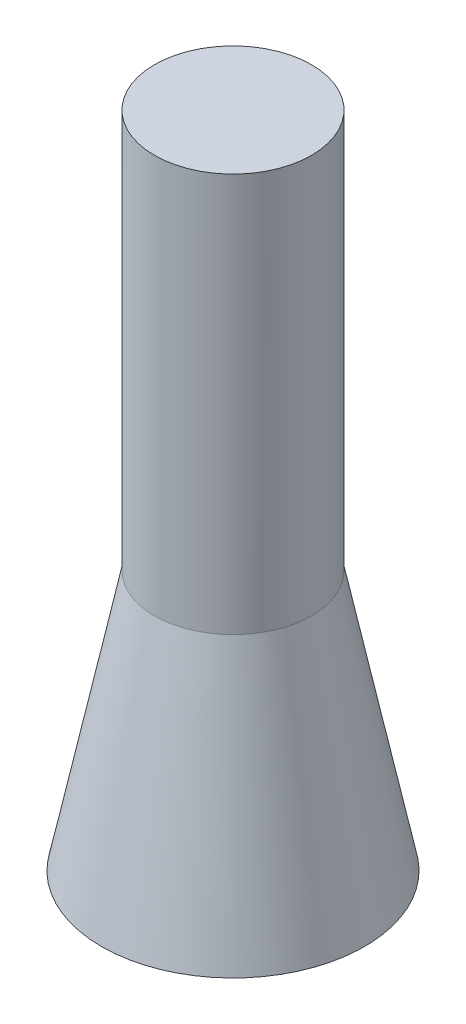
from build123d import *

# Parameters (mm, degrees)
SKETCH2_R           = 5.969
BOSS_EXTRUDE1_DEPTH = 50.066
SKETCH7_R           = 2.5
CUT_EXTRUDE2_DEPTH  = 20


with BuildPart() as part:
    # Sketch1 → Revolve1 (revolve)
    with BuildSketch(Plane.XY, mode=Mode.PRIVATE) as revolve1_sk:
        Polygon((0, 0), (-10, 0), (0, 48.989794856), align=None)
    revolve(revolve1_sk.sketch.rotate(Axis((0, 48.989794856, 0), (0, -1, 0)), 90), axis=Axis((0, 48.989794856, 0), (0, -1, 0)))

    # Sketch2 → Boss-Extrude1 (add)
    with BuildSketch(Plane(origin=(0, 0, 0), x_dir=(1, 0, 0), z_dir=(0, 1, 0))):
        with Locations(Location((0, 0, 0), (0, 0, 90))):
            Circle(SKETCH2_R)
    extrude(amount=BOSS_EXTRUDE1_DEPTH)

    # Sketch7 → Cut-Extrude2 (cut)
    with BuildSketch(Plane.XZ):
        with Locations(Location((0, 0, 0), (0, 0, 270))):
            Circle(SKETCH7_R)
    extrude(amount=-CUT_EXTRUDE2_DEPTH, mode=Mode.SUBTRACT)


solid = part.part
